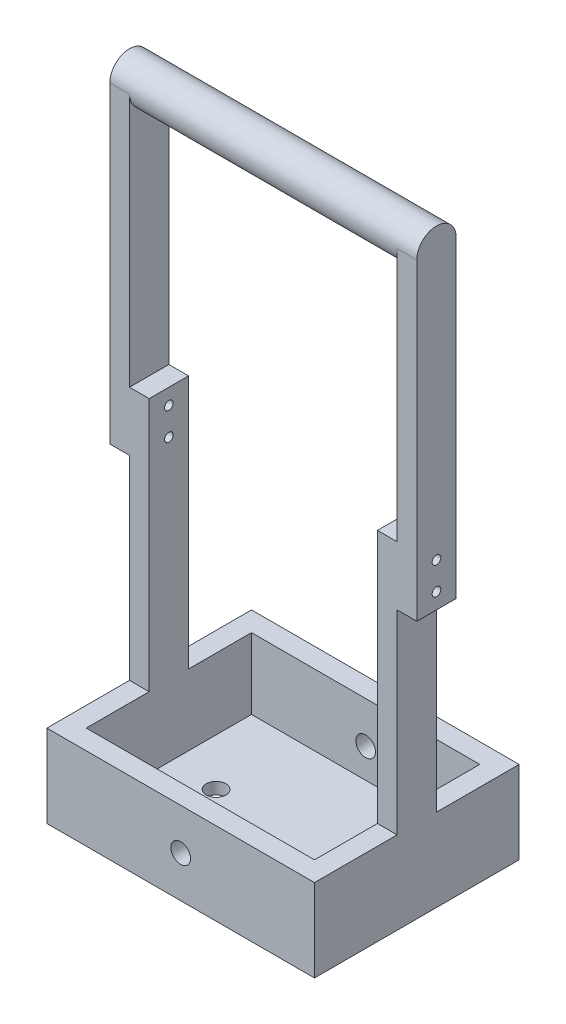
from build123d import *

# Parameters (mm, degrees)
SKETCH_1_W                      = 136
SKETCH_1_H                      = 104
EXTRUDE_1_DEPTH                 = 42
SKETCH_2_W                      = 116
SKETCH_2_H                      = 84
CUT_EXTRUDE_1_DEPTH             = 36
CUT_EXTRUDE_2_REACH             = 94.865
SKETCH_3_R                      = 5
SKETCH_5_R                      = 5
CUT_EXTRUDE_4_DEPTH             = 104
SKETCH_6_W                      = 10
SKETCH_6_H                      = 20
EXTRUDE_2_DEPTH                 = 258
SKETCH_8_W                      = 20
SKETCH_8_H                      = 30
EXTRUDE_4_DEPTH                 = 10
SKETCH_9_W                      = 10
SKETCH_9_H                      = 20
EXTRUDE_5_DEPTH                 = 129
SKETCH_10_W                     = 20
SKETCH_10_H                     = 30
EXTRUDE_6_DEPTH                 = 10
SKETCH_12_W                     = 10
SKETCH_12_H                     = 20
EXTRUDE_8_DEPTH                 = 129
SKETCH_13_W                     = 20
SKETCH_13_H                     = 129
CUT_EXTRUDE_5_DEPTH             = 10
SKETCH_14_W                     = 20
SKETCH_14_H                     = 129
CUT_EXTRUDE_6_DEPTH             = 10
SKETCH_15_R                     = 10
EXTRUDE_9_DEPTH                 = 156
CUT_EXTRUDE_7_REACH             = 344.491
SKETCH_16_R                     = 2.2
CUT_EXTRUDE_7_DIRECTION_2_DEPTH = 136


with BuildPart() as part:
    # 草图1 → 凸台-拉伸1 (new body)
    with BuildSketch(Plane(origin=(0, 0, 0), x_dir=(1, 0, 0), z_dir=(0, 1, 0))):
        Rectangle(SKETCH_1_W, SKETCH_1_H)
    extrude(amount=EXTRUDE_1_DEPTH)

    # 草图2 → 切除-拉伸1 (cut)
    with BuildSketch(Plane(origin=(0, 42, 0), x_dir=(1, 0, 0), z_dir=(0, 1, 0))):
        Rectangle(SKETCH_2_W, SKETCH_2_H)
    extrude(amount=-CUT_EXTRUDE_1_DEPTH, mode=Mode.SUBTRACT)

    # 草图3 → 切除-拉伸2 (cut, up to next)
    with BuildSketch(Plane(origin=(0, 6, 0), x_dir=(1, 0, 0), z_dir=(0, 1, 0)), mode=Mode.PRIVATE) as cut_extrude_2_sk1:
        with Locations(Location((-34, 0, 0), (0, 0, 270))):
            Circle(SKETCH_3_R)
    cut_extrude_2_tool1 = extrude(cut_extrude_2_sk1.sketch, amount=-CUT_EXTRUDE_2_REACH, mode=Mode.PRIVATE) & part.part
    # 草图3 → 切除-拉伸2 (cut, up to next)
    with BuildSketch(Plane(origin=(0, 6, 0), x_dir=(1, 0, 0), z_dir=(0, 1, 0)), mode=Mode.PRIVATE) as cut_extrude_2_sk2:
        with Locations(Location((34, 0, 0), (0, 0, 270))):
            Circle(SKETCH_3_R)
    cut_extrude_2_tool2 = extrude(cut_extrude_2_sk2.sketch, amount=-CUT_EXTRUDE_2_REACH, mode=Mode.PRIVATE) & part.part
    add(cut_extrude_2_tool1.solids().sort_by_distance((-34, 6, 0))[0], mode=Mode.SUBTRACT)
    add(cut_extrude_2_tool2.solids().sort_by_distance((34, 6, 0))[0], mode=Mode.SUBTRACT)

    # 草图5 → 切除-拉伸4 (cut)
    with BuildSketch(Plane.XY.offset(52)):
        with Locations((0, 21)):
            Circle(SKETCH_5_R)
    extrude(amount=-CUT_EXTRUDE_4_DEPTH, mode=Mode.SUBTRACT)

    # 草图6 → 凸台-拉伸2 (add)
    with BuildSketch(Plane(origin=(0, 42, 0), x_dir=(1, 0, 0), z_dir=(0, 1, 0))):
        with Locations((-63, 0)):
            Rectangle(SKETCH_6_W, SKETCH_6_H)
        with Locations((63, 0)):
            Rectangle(SKETCH_6_W, SKETCH_6_H)
    extrude(amount=EXTRUDE_2_DEPTH)

    # 草图8 → 凸台-拉伸4 (add)
    with BuildSketch(Plane.ZY.offset(68)):
        with Locations((0, 156)):
            Rectangle(SKETCH_8_W, SKETCH_8_H)
    extrude(amount=EXTRUDE_4_DEPTH)

    # 草图9 → 凸台-拉伸5 (add)
    with BuildSketch(Plane(origin=(0, 171, 0), x_dir=(1, 0, 0), z_dir=(0, 1, 0))):
        with Locations((-73, 0)):
            Rectangle(SKETCH_9_W, SKETCH_9_H)
    extrude(amount=EXTRUDE_5_DEPTH)

    # 草图10 → 凸台-拉伸6 (add)
    with BuildSketch(Plane(origin=(68, 0, 0), x_dir=(0, 0, -1), z_dir=(1, 0, 0))):
        with Locations((0, 156)):
            Rectangle(SKETCH_10_W, SKETCH_10_H)
    extrude(amount=EXTRUDE_6_DEPTH)

    # 草图12 → 凸台-拉伸8 (add)
    with BuildSketch(Plane(origin=(0, 171, 0), x_dir=(1, 0, 0), z_dir=(0, 1, 0))):
        with Locations((73, 0)):
            Rectangle(SKETCH_12_W, SKETCH_12_H)
    extrude(amount=EXTRUDE_8_DEPTH)

    # 草图13 → 切除-拉伸5 (cut)
    with BuildSketch(Plane(origin=(-58, 0, 0), x_dir=(0, 0, -1), z_dir=(1, 0, 0))):
        with Locations((0, 235.5)):
            Rectangle(SKETCH_13_W, SKETCH_13_H)
    extrude(amount=-CUT_EXTRUDE_5_DEPTH, mode=Mode.SUBTRACT)

    # 草图14 → 切除-拉伸6 (cut)
    with BuildSketch(Plane.ZY.offset(-58)):
        with Locations((0, 235.5)):
            Rectangle(SKETCH_14_W, SKETCH_14_H)
    extrude(amount=-CUT_EXTRUDE_6_DEPTH, mode=Mode.SUBTRACT)

    # 草图15 → 凸台-拉伸9 (add)
    with BuildSketch(Plane.ZY.offset(78)):
        with Locations((0, 300)):
            Circle(SKETCH_15_R)
    extrude(amount=-EXTRUDE_9_DEPTH)

    # 草图16 → 切除-拉伸7 (cut, up to next)
    with BuildSketch(Plane(origin=(-58, 0, 0), x_dir=(0, 0, -1), z_dir=(1, 0, 0)), mode=Mode.PRIVATE) as cut_extrude_7_sk1:
        with Locations((0, 163)):
            Circle(SKETCH_16_R)
    cut_extrude_7_tool1 = extrude(cut_extrude_7_sk1.sketch, amount=-CUT_EXTRUDE_7_REACH, mode=Mode.PRIVATE) & part.part
    # 草图16 → 切除-拉伸7 (cut, up to next)
    with BuildSketch(Plane(origin=(-58, 0, 0), x_dir=(0, 0, -1), z_dir=(1, 0, 0)), mode=Mode.PRIVATE) as cut_extrude_7_sk2:
        with Locations((0, 149)):
            Circle(SKETCH_16_R)
    cut_extrude_7_tool2 = extrude(cut_extrude_7_sk2.sketch, amount=-CUT_EXTRUDE_7_REACH, mode=Mode.PRIVATE) & part.part
    add(cut_extrude_7_tool1.solids().sort_by_distance((-58, 163, 0))[0], mode=Mode.SUBTRACT)
    add(cut_extrude_7_tool2.solids().sort_by_distance((-58, 149, 0))[0], mode=Mode.SUBTRACT)

    # 草图16 → 切除-拉伸7 direction 2 (cut)
    with BuildSketch(Plane(origin=(-58, 0, 0), x_dir=(0, 0, -1), z_dir=(1, 0, 0))):
        with Locations((0, 163)):
            Circle(SKETCH_16_R)
        with Locations((0, 149)):
            Circle(SKETCH_16_R)
    extrude(amount=CUT_EXTRUDE_7_DIRECTION_2_DEPTH, mode=Mode.SUBTRACT)


solid = part.part
